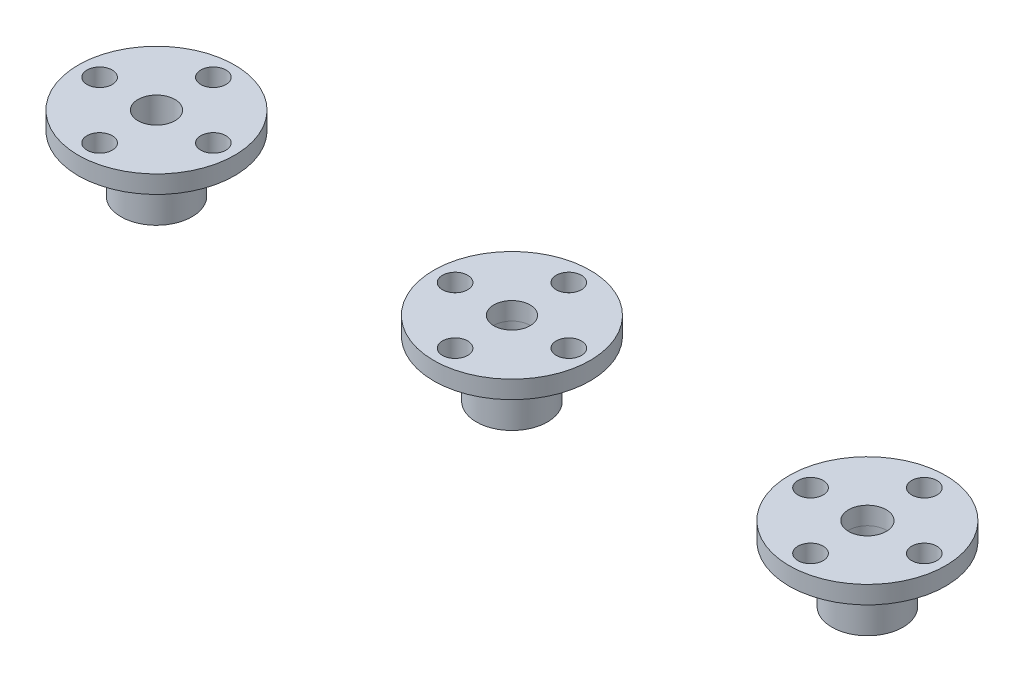
from build123d import *

# Parameters (mm, degrees)
SKETCH_1_R        = 5
SKETCH_1_R_2      = 2.55
EXTRUDE_1_DEPTH   = 8
SKETCH_1_R_3      = 2.6
EXTRUDE_1_2_DEPTH = 8
SKETCH_1_R_4      = 2.65
EXTRUDE_1_3_DEPTH = 8
SKETCH_3_R        = 11
SKETCH_3_R_2      = 2.6
SKETCH_3_R_3      = 1.775
SKETCH_3_R_4      = 2.55
SKETCH_3_R_5      = 2.65
EXTRUDE_2_DEPTH   = 2.5


with BuildPart() as part:
    # 草图1 → 凸台-拉伸1 (new body)
    with BuildSketch(Plane(origin=(0, 0, 0), x_dir=(1, 0, 0), z_dir=(0, 1, 0))):
        with Locations(Location((0, 0, 0), (0, 0, 270))):
            Circle(SKETCH_1_R)
        with Locations(Location((0, 0, 0), (0, 0, 270))):
            Circle(SKETCH_1_R_2, mode=Mode.SUBTRACT)
    extrude(amount=EXTRUDE_1_DEPTH)


with BuildPart() as body_2:
    # 草图1 → Extrude 1 2 (new body)
    with BuildSketch(Plane(origin=(0, 0, 0), x_dir=(1, 0, 0), z_dir=(0, 1, 0))):
        with Locations(Location((-50, 0, 0), (0, 0, 270))):
            Circle(SKETCH_1_R)
        with Locations(Location((-50, 0, 0), (0, 0, 270))):
            Circle(SKETCH_1_R_3, mode=Mode.SUBTRACT)
    extrude(amount=EXTRUDE_1_2_DEPTH)

    # 草图3 → 凸台-拉伸2 (add)
    # profile 1 of 3: a face of its own
    with BuildSketch(Plane(origin=(0, 8, 0), x_dir=(1, 0, 0), z_dir=(0, 1, 0))):
        with Locations(Location((-50, 0, 0), (0, 0, 270))):
            Circle(SKETCH_3_R)
        with Locations(Location((-50, 0, 0), (0, 0, 270))):
            Circle(SKETCH_3_R_2, mode=Mode.SUBTRACT)
        with Locations(Location((-50, 8, 0), (0, 0, 270))):
            Circle(SKETCH_3_R_3, mode=Mode.SUBTRACT)
        with Locations(Location((-42, 0, 0), (0, 0, 270))):
            Circle(SKETCH_3_R_3, mode=Mode.SUBTRACT)
        with Locations(Location((-50, -8, 0), (0, 0, 270))):
            Circle(SKETCH_3_R_3, mode=Mode.SUBTRACT)
        with Locations(Location((-58, 0, 0), (0, 0, 270))):
            Circle(SKETCH_3_R_3, mode=Mode.SUBTRACT)
    # profile 2 of 3: a face of its own
    with BuildSketch(Plane(origin=(0, 8, 0), x_dir=(1, 0, 0), z_dir=(0, 1, 0))):
        with Locations(Location((0, 0, 0), (0, 0, 270))):
            Circle(SKETCH_3_R)
        with Locations(Location((0, 0, 0), (0, 0, 270))):
            Circle(SKETCH_3_R_4, mode=Mode.SUBTRACT)
        with Locations(Location((0, 8, 0), (0, 0, 270))):
            Circle(SKETCH_3_R_3, mode=Mode.SUBTRACT)
        with Locations(Location((8, 0, 0), (0, 0, 270))):
            Circle(SKETCH_3_R_3, mode=Mode.SUBTRACT)
        with Locations(Location((0, -8, 0), (0, 0, 270))):
            Circle(SKETCH_3_R_3, mode=Mode.SUBTRACT)
        with Locations(Location((-8, 0, 0), (0, 0, 270))):
            Circle(SKETCH_3_R_3, mode=Mode.SUBTRACT)
    # profile 3 of 3: a face of its own
    with BuildSketch(Plane(origin=(0, 8, 0), x_dir=(1, 0, 0), z_dir=(0, 1, 0))):
        with Locations(Location((50, 0, 0), (0, 0, 270))):
            Circle(SKETCH_3_R)
        with Locations(Location((50, 0, 0), (0, 0, 270))):
            Circle(SKETCH_3_R_5, mode=Mode.SUBTRACT)
        with Locations(Location((50, 8, 0), (0, 0, 270))):
            Circle(SKETCH_3_R_3, mode=Mode.SUBTRACT)
        with Locations(Location((58, 0, 0), (0, 0, 270))):
            Circle(SKETCH_3_R_3, mode=Mode.SUBTRACT)
        with Locations(Location((50, -8, 0), (0, 0, 270))):
            Circle(SKETCH_3_R_3, mode=Mode.SUBTRACT)
        with Locations(Location((42, 0, 0), (0, 0, 270))):
            Circle(SKETCH_3_R_3, mode=Mode.SUBTRACT)
    extrude(amount=EXTRUDE_2_DEPTH)


with BuildPart() as body_3:
    # 草图1 → Extrude 1 3 (new body)
    with BuildSketch(Plane(origin=(0, 0, 0), x_dir=(1, 0, 0), z_dir=(0, 1, 0))):
        with Locations(Location((50, 0, 0), (0, 0, 270))):
            Circle(SKETCH_1_R)
        with Locations(Location((50, 0, 0), (0, 0, 270))):
            Circle(SKETCH_1_R_4, mode=Mode.SUBTRACT)
    extrude(amount=EXTRUDE_1_3_DEPTH)


with BuildPart() as extrude_2_piece_1:
    # of the separate pieces the step leaves, piece 1, a body of its own (extrude_2_pieces)
    add(body_2.part.solids().sort_by_distance((-50, 0, 5))[0])


with BuildPart() as extrude_2_piece_2:
    # of the separate pieces the step leaves, piece 2, a body of its own (extrude_2_pieces)
    add(body_2.part.solids().sort_by_distance((0, 8, 11))[0])


with BuildPart() as extrude_2_piece_3:
    # of the separate pieces the step leaves, piece 3, a body of its own (extrude_2_pieces)
    add(body_2.part.solids().sort_by_distance((50, 8, 11))[0])


solid = Compound([part.part, body_3.part, extrude_2_piece_1.part, extrude_2_piece_2.part, extrude_2_piece_3.part])
